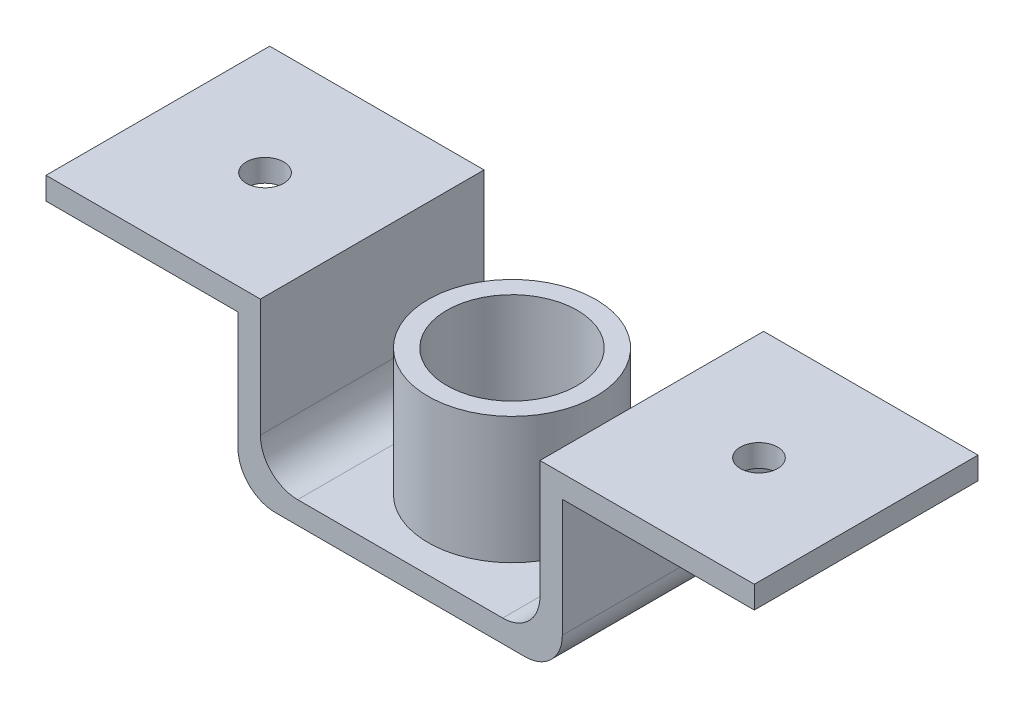
from build123d import *

# Parameters (mm, degrees)
BOSS_EXTRUDE1_DEPTH = 300
SKETCH3_R           = 25
CUT_EXTRUDE1_DEPTH  = 1025.277306202
BOSS_EXTRUDE2_START = -208
SKETCH3_3_R         = 112.5
SKETCH3_3_R_2       = 87.5
BOSS_EXTRUDE2_DEPTH = 170
SKETCH3_6_R         = 37.5
CUT_EXTRUDE2_DEPTH  = 1025.277306202


with BuildPart() as part:
    # Sketch1 → Boss-Extrude1 (new body)
    with BuildSketch(Plane.XY):
        with BuildLine():
            Line((0, 0), (287.5, 0))
            Line((287.5, 0), (287.5, -158))
            ThreePointArc((287.5, -158), (302.144660941, -193.355339059), (337.5, -208))
            Line((337.5, -208), (612.5, -208))
            ThreePointArc((612.5, -208), (647.855339059, -193.355339059), (662.5, -158))
            Line((662.5, -158), (662.5, 0))
            Line((662.5, 0), (950, 0))
            Line((950, 0), (950, -30))
            Line((950, -30), (692.5, -30))
            Line((692.5, -30), (692.5, -188))
            ThreePointArc((692.5, -188), (677.855339059, -223.355339059), (642.5, -238))
            Line((642.5, -238), (307.5, -238))
            ThreePointArc((307.5, -238), (272.144660941, -223.355339059), (257.5, -188))
            Line((257.5, -188), (257.5, -30))
            Line((257.5, -30), (0, -30))
            Line((0, -30), (0, 0))
        make_face()
    extrude(amount=BOSS_EXTRUDE1_DEPTH)

    # Sketch3 → Cut-Extrude1 (cut, through all)
    with BuildSketch(Plane(origin=(0, 0, 0), x_dir=(1, 0, 0), z_dir=(0, 1, 0))):
        with Locations(Location((143.75, -150, 0), (0, 0, 270))):
            Circle(SKETCH3_R)
        with Locations(Location((806.25, -150, 0), (0, 0, 270))):
            Circle(SKETCH3_R)
    extrude(amount=-CUT_EXTRUDE1_DEPTH, mode=Mode.SUBTRACT)

    # Sketch3<6> → Cut-Extrude2 (cut, through all)
    with BuildSketch(Plane(origin=(0, 0, 0), x_dir=(1, 0, 0), z_dir=(0, 1, 0))):
        with Locations(Location((475, -150, 0), (0, 0, 270))):
            Circle(SKETCH3_6_R)
    extrude(amount=-CUT_EXTRUDE2_DEPTH, mode=Mode.SUBTRACT)


with BuildPart() as body_2:
    # Sketch3<3> → Boss-Extrude2 (new body)
    with BuildSketch(Plane(origin=(0, 0, 0), x_dir=(1, 0, 0), z_dir=(0, 1, 0)).offset(BOSS_EXTRUDE2_START)):
        with Locations(Location((475, -150, 0), (0, 0, 90))):
            Circle(SKETCH3_3_R)
        with Locations(Location((475, -150, 0), (0, 0, 90))):
            Circle(SKETCH3_3_R_2, mode=Mode.SUBTRACT)
    extrude(amount=BOSS_EXTRUDE2_DEPTH)


solid = Compound([part.part, body_2.part])
